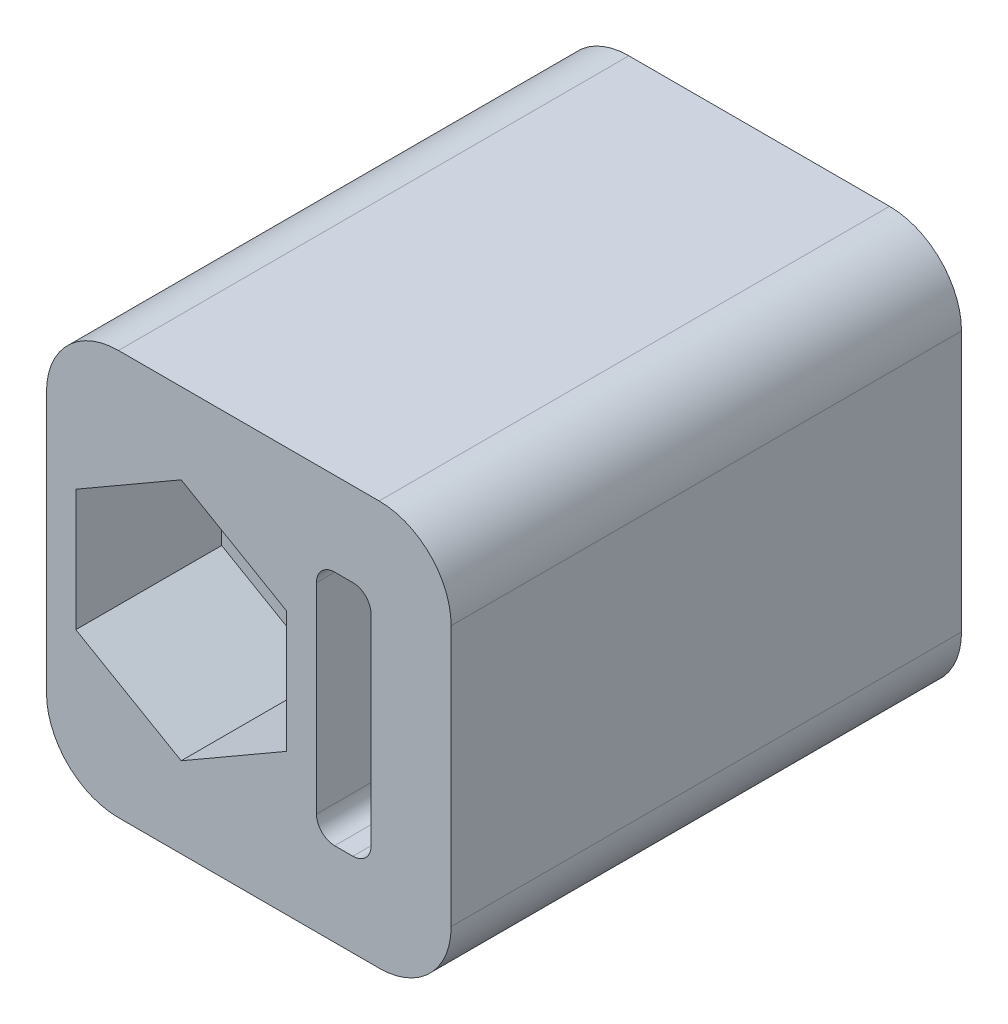
from build123d import *

# Parameters (mm, degrees)
SKETCH1_R           = 1.7
BOSS_EXTRUDE1_DEPTH = 14
CUT_EXTRUDE1_DEPTH  = 4
CUT_EXTRUDE2_DEPTH  = 7


with BuildPart() as part:
    # Sketch1 → Boss-Extrude1 (new body)
    with BuildSketch(Plane.XY):
        with BuildLine():
            Line((-3.695, -3.575), (-3.695, 3.575))
            ThreePointArc((-3.695, 3.575), (-3.116535893, 4.971535893), (-1.72, 5.55))
            Line((-1.72, 5.55), (5.43, 5.55))
            ThreePointArc((5.43, 5.55), (6.826535893, 4.971535893), (7.405, 3.575))
            Line((7.405, 3.575), (7.405, -3.575))
            ThreePointArc((7.405, -3.575), (6.826535893, -4.971535893), (5.43, -5.55))
            Line((5.43, -5.55), (-1.72, -5.55))
            ThreePointArc((-1.72, -5.55), (-3.116535893, -4.971535893), (-3.695, -3.575))
        make_face()
        Circle(SKETCH1_R, mode=Mode.SUBTRACT)
        with BuildLine():
            Line((5.21, 2.75), (5.21, -2.75))
            ThreePointArc((5.21, -2.75), (5.063553391, -3.103553391), (4.71, -3.25))
            Line((4.71, -3.25), (4.21, -3.25))
            ThreePointArc((4.21, -3.25), (3.856446609, -3.103553391), (3.71, -2.75))
            Line((3.71, -2.75), (3.71, 2.75))
            ThreePointArc((3.71, 2.75), (3.856446609, 3.103553391), (4.21, 3.25))
            Line((4.21, 3.25), (4.71, 3.25))
            ThreePointArc((4.71, 3.25), (5.063553391, 3.103553391), (5.21, 2.75))
        make_face(mode=Mode.SUBTRACT)
    extrude(amount=BOSS_EXTRUDE1_DEPTH)

    # Sketch2 → Cut-Extrude1 (cut)
    with BuildSketch(Plane.XY.offset(14)):
        Polygon((0, 3.337084556), (-2.89, 1.668542278), (-2.89, -1.668542278), (0, -3.337084556), (2.89, -1.668542278), (2.89, 1.668542278), align=None)
    extrude(amount=-CUT_EXTRUDE1_DEPTH, mode=Mode.SUBTRACT)

    # Sketch3 → Cut-Extrude2 (cut)
    with BuildSketch(Plane.XY):
        with BuildLine():
            Line((3.71, 2.75), (3.71, -2.75))
            ThreePointArc((3.71, -2.75), (3.856446609, -3.103553391), (4.21, -3.25))
            Line((4.21, -3.25), (5.51, -3.25))
            ThreePointArc((5.51, -3.25), (5.863553391, -3.103553391), (6.01, -2.75))
            Line((6.01, -2.75), (6.01, 2.75))
            ThreePointArc((6.01, 2.75), (5.863553391, 3.103553391), (5.51, 3.25))
            Line((5.51, 3.25), (4.21, 3.25))
            ThreePointArc((4.21, 3.25), (3.856446609, 3.103553391), (3.71, 2.75))
        make_face()
    extrude(amount=CUT_EXTRUDE2_DEPTH, mode=Mode.SUBTRACT)


solid = part.part
